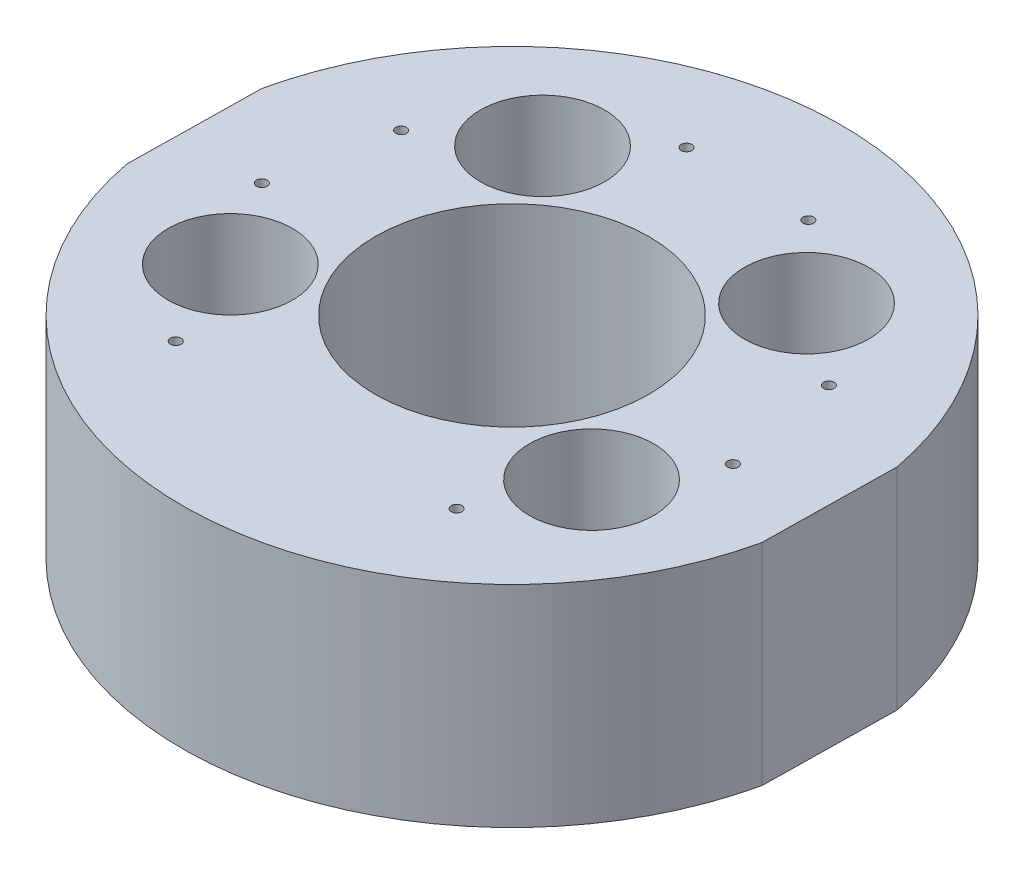
from build123d import *

# Parameters (mm, degrees)
SKETCH1_R           = 25.667
SKETCH1_R_2         = 11.666
BOSS_EXTRUDE1_DEPTH = 39.5
SKETCH3_R           = 1
CUT_EXTRUDE2_DEPTH  = 12


with BuildPart() as part:
    # Sketch1 → Boss-Extrude1 (new body)
    with BuildSketch(Plane(origin=(0, 0, 0), x_dir=(0.9998860245595665, 0, -0.015097612078275651), z_dir=(0, 1, 0))):
        with BuildLine():
            Line((-61.169473244, 13.237048576), (-61.945593174, -11.750901277))
            ThreePointArc((-61.945593174, -11.750901277), (-2.965804858, -62.923588573), (59.076056366, -15.509805654))
            Line((59.076056366, -15.509805654), (59.852176295, 9.478144199))
            ThreePointArc((59.852176295, 9.478144199), (0.872387979, 60.650831495), (-61.169473244, 13.237048576))
        make_face()
        with Locations(Location((-1.046708439, -1.136378539, 0), (0, 0, 269.134937682))):
            Circle(SKETCH1_R, mode=Mode.SUBTRACT)
        with Locations(Location((-25.270455744, 29.647637614, 0), (0, 0, 269.134937682))):
            Circle(SKETCH1_R_2, mode=Mode.SUBTRACT)
        with Locations(Location((25.040791951, 28.084981925, 0), (0, 0, 269.134937682))):
            Circle(SKETCH1_R_2, mode=Mode.SUBTRACT)
        with Locations(Location((32.795299128, -20.863621322, 0), (0, 0, 269.134937682))):
            Circle(SKETCH1_R_2, mode=Mode.SUBTRACT)
        with Locations(Location((-36.047749659, -18.725372188, 0), (0, 0, 269.134937682))):
            Circle(SKETCH1_R_2, mode=Mode.SUBTRACT)
    extrude(amount=BOSS_EXTRUDE1_DEPTH)

    # Sketch3 → Cut-Extrude2 (cut)
    with BuildSketch(Plane(origin=(-5.108058327, 40.5, 5.9056653), x_dir=(0.9998727759206764, 0, 0.01595092388174038), z_dir=(0, 1, 0))):
        with Locations(Location((-7.611198514, 48.293658122, 0), (0, 0, 180.913959377))):
            Circle(SKETCH3_R)
        with Locations(Location((15.615763239, 48.293658122, 0), (0, 0, 180.913959377))):
            Circle(SKETCH3_R)
        with Locations(Location((44.786132779, 23.835888335, 0), (0, 0, 180.913959377))):
            Circle(SKETCH3_R)
        with Locations(Location((48.921303074, 2.119626579, 0), (0, 0, 180.913959377))):
            Circle(SKETCH3_R)
        with Locations(Location((30.780788542, -31.346994024, 0), (0, 0, 180.913959377))):
            Circle(SKETCH3_R)
        with Locations(Location((-22.776223816, -31.346994024, 0), (0, 0, 180.913959377))):
            Circle(SKETCH3_R)
        with Locations(Location((-40.916738349, 2.119626579, 0), (0, 0, 180.913959377))):
            Circle(SKETCH3_R)
        with Locations(Location((-36.781568054, 23.835888335, 0), (0, 0, 180.913959377))):
            Circle(SKETCH3_R)
    extrude(amount=-CUT_EXTRUDE2_DEPTH, mode=Mode.SUBTRACT)


solid = part.part
